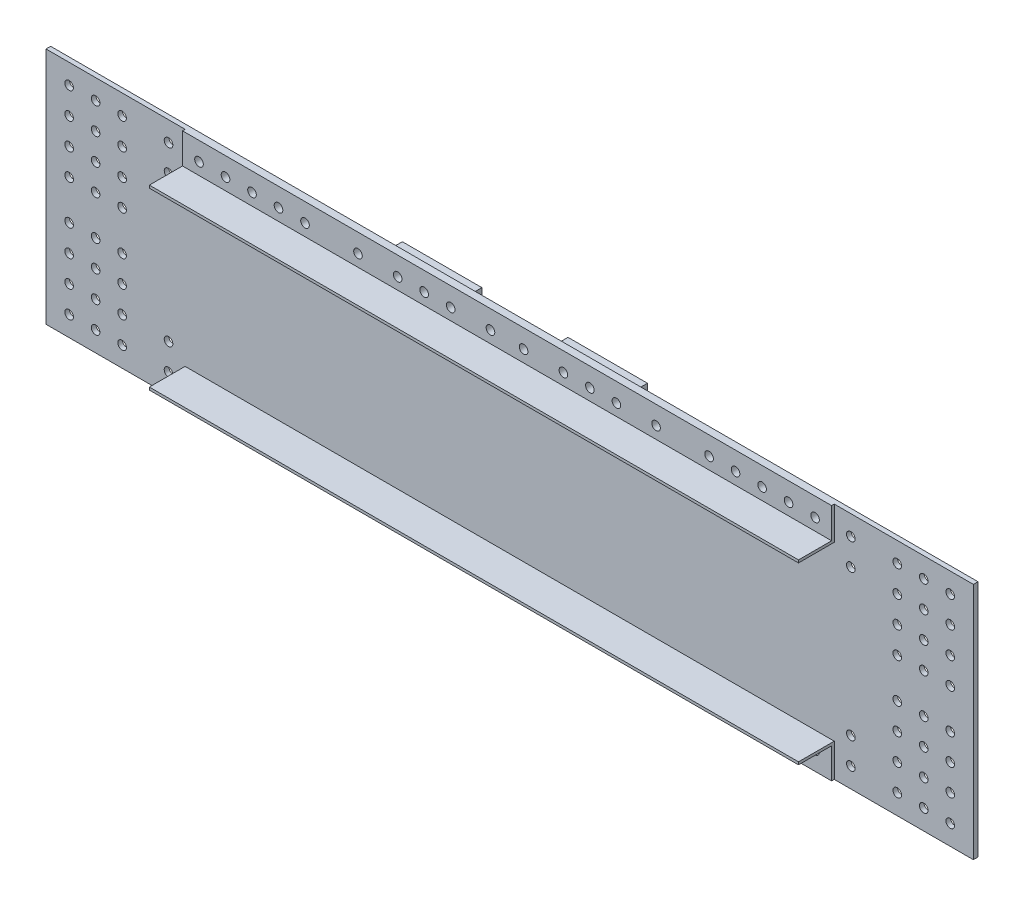
from build123d import *

# Parameters (mm, degrees)
SKETCH_1_W                  = 2800
SKETCH_1_H                  = 720
EXTRUDE_1_DEPTH             = 14
SKETCH_3_R                  = 13
CUT_EXTRUDE_1_DEPTH         = 1446.612672883
PATTERN_LINEAR_1_COUNT      = 3
PATTERN_LINEAR_1_PITCH      = 80
PATTERN_LINEAR_1_COUNT_DIR2 = 4
PATTERN_LINEAR_1_PITCH_DIR2 = 80
SKETCH_4_R                  = 13
CUT_EXTRUDE_2_DEPTH         = 1446.612672883
PATTERN_LINEAR_2_COUNT      = 2
PATTERN_LINEAR_2_PITCH      = 80
MIRROR_1_COPY_1_SKETCH_R    = 13
MIRROR_1_COPY_1_DEPTH       = 1446.612672883
MIRROR_1_COPY_2_SKETCH_R    = 13
MIRROR_1_COPY_2_DEPTH       = 1446.612672883
MIRROR_1_COPY_3_SKETCH_R    = 13
MIRROR_1_COPY_3_DEPTH       = 1446.612672883
MIRROR_1_COPY_4_SKETCH_R    = 13
MIRROR_1_COPY_4_DEPTH       = 1446.612672883
MIRROR_1_COPY_5_SKETCH_R    = 13
MIRROR_1_COPY_5_DEPTH       = 1446.612672883
MIRROR_1_COPY_6_SKETCH_R    = 13
MIRROR_1_COPY_6_DEPTH       = 1446.612672883
MIRROR_1_COPY_7_SKETCH_R    = 13
MIRROR_1_COPY_7_DEPTH       = 1446.612672883
MIRROR_1_COPY_8_SKETCH_R    = 13
MIRROR_1_COPY_8_DEPTH       = 1446.612672883
MIRROR_1_COPY_9_SKETCH_R    = 13
MIRROR_1_COPY_9_DEPTH       = 1446.612672883
MIRROR_1_COPY_10_SKETCH_R   = 13
MIRROR_1_COPY_10_DEPTH      = 1446.612672883
MIRROR_1_COPY_11_SKETCH_R   = 13
MIRROR_1_COPY_11_DEPTH      = 1446.612672883
MIRROR_1_COPY_12_SKETCH_R   = 13
MIRROR_1_COPY_12_DEPTH      = 1446.612672883
MIRROR_2_COPY_1_SKETCH_R    = 13
MIRROR_2_COPY_1_DEPTH       = 1446.612672883
MIRROR_2_COPY_2_SKETCH_R    = 13
MIRROR_2_COPY_2_DEPTH       = 1446.612672883
MIRROR_2_COPY_3_SKETCH_R    = 13
MIRROR_2_COPY_3_DEPTH       = 1446.612672883
MIRROR_2_COPY_4_SKETCH_R    = 13
MIRROR_2_COPY_4_DEPTH       = 1446.612672883
MIRROR_2_COPY_5_SKETCH_R    = 13
MIRROR_2_COPY_5_DEPTH       = 1446.612672883
MIRROR_2_COPY_6_SKETCH_R    = 13
MIRROR_2_COPY_6_DEPTH       = 1446.612672883
MIRROR_2_COPY_7_SKETCH_R    = 13
MIRROR_2_COPY_7_DEPTH       = 1446.612672883
MIRROR_2_COPY_8_SKETCH_R    = 13
MIRROR_2_COPY_8_DEPTH       = 1446.612672883
MIRROR_2_COPY_9_SKETCH_R    = 13
MIRROR_2_COPY_9_DEPTH       = 1446.612672883
MIRROR_2_COPY_10_SKETCH_R   = 13
MIRROR_2_COPY_10_DEPTH      = 1446.612672883
MIRROR_2_COPY_11_SKETCH_R   = 13
MIRROR_2_COPY_11_DEPTH      = 1446.612672883
MIRROR_2_COPY_12_SKETCH_R   = 13
MIRROR_2_COPY_12_DEPTH      = 1446.612672883
MIRROR_2_COPY_13_SKETCH_R   = 13
MIRROR_2_COPY_13_DEPTH      = 1446.612672883
MIRROR_2_COPY_14_SKETCH_R   = 13
MIRROR_2_COPY_14_DEPTH      = 1446.612672883
MIRROR_2_COPY_15_SKETCH_R   = 13
MIRROR_2_COPY_15_DEPTH      = 1446.612672883
MIRROR_2_COPY_16_SKETCH_R   = 13
MIRROR_2_COPY_16_DEPTH      = 1446.612672883
MIRROR_2_COPY_17_SKETCH_R   = 13
MIRROR_2_COPY_17_DEPTH      = 1446.612672883
MIRROR_2_COPY_18_SKETCH_R   = 13
MIRROR_2_COPY_18_DEPTH      = 1446.612672883
MIRROR_2_COPY_19_SKETCH_R   = 13
MIRROR_2_COPY_19_DEPTH      = 1446.612672883
MIRROR_2_COPY_20_SKETCH_R   = 13
MIRROR_2_COPY_20_DEPTH      = 1446.612672883
MIRROR_2_COPY_21_SKETCH_R   = 13
MIRROR_2_COPY_21_DEPTH      = 1446.612672883
MIRROR_2_COPY_22_SKETCH_R   = 13
MIRROR_2_COPY_22_DEPTH      = 1446.612672883
MIRROR_2_COPY_23_SKETCH_R   = 13
MIRROR_2_COPY_23_DEPTH      = 1446.612672883
MIRROR_2_COPY_24_SKETCH_R   = 13
MIRROR_2_COPY_24_DEPTH      = 1446.612672883
MIRROR_2_COPY_25_SKETCH_R   = 13
MIRROR_2_COPY_25_DEPTH      = 1446.612672883
MIRROR_2_COPY_26_SKETCH_R   = 13
MIRROR_2_COPY_26_DEPTH      = 1446.612672883
SKETCH_5_W                  = 980
SKETCH_5_H                  = 100
EXTRUDE_2_DEPTH             = 8
SKETCH_7_R                  = 13
CUT_EXTRUDE_3_DEPTH         = 1446.712281196
PATTERN_LINEAR_3_COUNT      = 5
PATTERN_LINEAR_3_PITCH      = 80
SKETCH_8_R                  = 13
CUT_EXTRUDE_4_DEPTH         = 1446.712281196
SKETCH_9_W                  = 980
SKETCH_9_H                  = 8
EXTRUDE_3_DEPTH             = 100
MIRROR_3_COPY_1_SKETCH_R    = 13
MIRROR_3_COPY_1_DEPTH       = 1446.712281196
MIRROR_3_COPY_2_SKETCH_R    = 13
MIRROR_3_COPY_2_DEPTH       = 1446.712281196
MIRROR_3_COPY_3_SKETCH_R    = 13
MIRROR_3_COPY_3_DEPTH       = 1446.712281196
MIRROR_3_COPY_4_SKETCH_R    = 13
MIRROR_3_COPY_4_DEPTH       = 1446.712281196
MIRROR_4_COPY_1_SKETCH_R    = 13
MIRROR_4_COPY_1_DEPTH       = 1446.712281196
MIRROR_4_COPY_2_SKETCH_R    = 13
MIRROR_4_COPY_2_DEPTH       = 1446.712281196
MIRROR_4_COPY_3_SKETCH_R    = 13
MIRROR_4_COPY_3_DEPTH       = 1446.712281196
MIRROR_4_COPY_4_SKETCH_R    = 13
MIRROR_4_COPY_4_DEPTH       = 1446.712281196
MIRROR_4_COPY_5_SKETCH_W    = 980
MIRROR_4_COPY_5_SKETCH_H    = 100
MIRROR_4_COPY_5_DEPTH       = 8
MIRROR_4_COPY_6_SKETCH_R    = 13
MIRROR_4_COPY_6_DEPTH       = 1446.712281196
MIRROR_4_COPY_7_SKETCH_R    = 13
MIRROR_4_COPY_7_DEPTH       = 1446.712281196
MIRROR_4_COPY_8_SKETCH_W    = 980
MIRROR_4_COPY_8_SKETCH_H    = 8
MIRROR_4_COPY_8_DEPTH       = 100
MIRROR_4_COPY_9_SKETCH_R    = 13
MIRROR_4_COPY_9_DEPTH       = 1446.712281196
MIRROR_4_COPY_10_SKETCH_R   = 13
MIRROR_4_COPY_10_DEPTH      = 1446.712281196
MIRROR_4_COPY_11_SKETCH_R   = 13
MIRROR_4_COPY_11_DEPTH      = 1446.712281196
MIRROR_4_COPY_12_SKETCH_R   = 13
MIRROR_4_COPY_12_DEPTH      = 1446.712281196
MIRROR_4_COPY_13_SKETCH_W   = 980
MIRROR_4_COPY_13_SKETCH_H   = 8
MIRROR_4_COPY_13_DEPTH      = 100
SKETCH_11_W                 = 240
SKETCH_11_H                 = 80
EXTRUDE_4_DEPTH             = 32
SKETCH_12_R                 = 13
CUT_EXTRUDE_5_DEPTH         = 1449.999654934
PATTERN_LINEAR_4_COUNT      = 3
PATTERN_LINEAR_4_PITCH      = 80
SKETCH_11_3_W               = 240
SKETCH_11_3_H               = 80
EXTRUDE_6_DEPTH             = 54
SKETCH_13_R                 = 13
CUT_EXTRUDE_6_DEPTH         = 1449.999654934
PATTERN_LINEAR_5_COUNT      = 3
PATTERN_LINEAR_5_PITCH      = 80
MIRROR_7_COPY_1_SKETCH_R    = 13
MIRROR_7_COPY_1_DEPTH       = 1449.999654934
MIRROR_7_COPY_2_SKETCH_R    = 13
MIRROR_7_COPY_2_DEPTH       = 1449.999654934
MIRROR_8_COPY_1_SKETCH_R    = 13
MIRROR_8_COPY_1_DEPTH       = 1449.999654934
MIRROR_8_COPY_2_SKETCH_R    = 13
MIRROR_8_COPY_2_DEPTH       = 1449.999654934
MIRROR_8_COPY_3_SKETCH_W    = 240
MIRROR_8_COPY_3_SKETCH_H    = 80
MIRROR_8_COPY_3_DEPTH       = 54
MIRROR_8_COPY_4_SKETCH_R    = 13
MIRROR_8_COPY_4_DEPTH       = 1449.999654934
MIRROR_8_COPY_5_SKETCH_R    = 13
MIRROR_8_COPY_5_DEPTH       = 1449.999654934
MIRROR_8_COPY_6_SKETCH_R    = 13
MIRROR_8_COPY_6_DEPTH       = 1449.999654934


with BuildPart() as part:
    # 草图1 → 凸台-拉伸1 (new body)
    with BuildSketch(Plane.XY):
        Rectangle(SKETCH_1_W, SKETCH_1_H)
    extrude(amount=EXTRUDE_1_DEPTH)

    # 草图3 → 切除-拉伸1 (cut, through all)
    with BuildSketch(Plane.XY.offset(14)):
        with Locations((-1330.210648338, 299.636572569)):
            Circle(SKETCH_3_R)
    cut_extrude_1 = extrude(amount=-CUT_EXTRUDE_1_DEPTH, mode=Mode.SUBTRACT)

    # 阵列(线性)1: Cut-Extrude 1 3 × 4
    with Locations(*[(i * PATTERN_LINEAR_1_PITCH, -j * PATTERN_LINEAR_1_PITCH_DIR2, 0) for i in range(PATTERN_LINEAR_1_COUNT) for j in range(PATTERN_LINEAR_1_COUNT_DIR2) if (i, j) != (0, 0)]):
        add(cut_extrude_1, mode=Mode.SUBTRACT)

    # 草图4 → 切除-拉伸2 (cut, through all)
    with BuildSketch(Plane.XY.offset(14)):
        with Locations((-1030.029167404, 300.016103943)):
            Circle(SKETCH_4_R)
    cut_extrude_2 = extrude(amount=-CUT_EXTRUDE_2_DEPTH, mode=Mode.SUBTRACT)

    # 阵列(线性)2: 切除-拉伸2 ×2
    with Locations(*[(0, -i * PATTERN_LINEAR_2_PITCH, 0) for i in range(1, PATTERN_LINEAR_2_COUNT)]):
        add(cut_extrude_2, mode=Mode.SUBTRACT)

    # 镜向1: 切除-拉伸1, 切除-拉伸2 across plane
    add(cut_extrude_1.mirror(Plane.ZX), mode=Mode.SUBTRACT)
    add(cut_extrude_2.mirror(Plane.ZX), mode=Mode.SUBTRACT)

    # 镜向1 copy 1 sketch → 镜向1 copy 1 (cut, through all)
    with BuildSketch(Plane(origin=(0, 80, 14), x_dir=(1, 0, 0), z_dir=(0, 0, 1))):
        with Locations((-1330.210648338, -299.636572569)):
            Circle(MIRROR_1_COPY_1_SKETCH_R)
    extrude(amount=-MIRROR_1_COPY_1_DEPTH, mode=Mode.SUBTRACT)

    # 镜向1 copy 2 sketch → 镜向1 copy 2 (cut, through all)
    with BuildSketch(Plane(origin=(0, 160, 14), x_dir=(1, 0, 0), z_dir=(0, 0, 1))):
        with Locations((-1330.210648338, -299.636572569)):
            Circle(MIRROR_1_COPY_2_SKETCH_R)
    extrude(amount=-MIRROR_1_COPY_2_DEPTH, mode=Mode.SUBTRACT)

    # 镜向1 copy 3 sketch → 镜向1 copy 3 (cut, through all)
    with BuildSketch(Plane(origin=(0, 240, 14), x_dir=(1, 0, 0), z_dir=(0, 0, 1))):
        with Locations((-1330.210648338, -299.636572569)):
            Circle(MIRROR_1_COPY_3_SKETCH_R)
    extrude(amount=-MIRROR_1_COPY_3_DEPTH, mode=Mode.SUBTRACT)

    # 镜向1 copy 4 sketch → 镜向1 copy 4 (cut, through all)
    with BuildSketch(Plane(origin=(80, 0, 14), x_dir=(1, 0, 0), z_dir=(0, 0, 1))):
        with Locations((-1330.210648338, -299.636572569)):
            Circle(MIRROR_1_COPY_4_SKETCH_R)
    extrude(amount=-MIRROR_1_COPY_4_DEPTH, mode=Mode.SUBTRACT)

    # 镜向1 copy 5 sketch → 镜向1 copy 5 (cut, through all)
    with BuildSketch(Plane(origin=(80, 80, 14), x_dir=(1, 0, 0), z_dir=(0, 0, 1))):
        with Locations((-1330.210648338, -299.636572569)):
            Circle(MIRROR_1_COPY_5_SKETCH_R)
    extrude(amount=-MIRROR_1_COPY_5_DEPTH, mode=Mode.SUBTRACT)

    # 镜向1 copy 6 sketch → 镜向1 copy 6 (cut, through all)
    with BuildSketch(Plane(origin=(80, 160, 14), x_dir=(1, 0, 0), z_dir=(0, 0, 1))):
        with Locations((-1330.210648338, -299.636572569)):
            Circle(MIRROR_1_COPY_6_SKETCH_R)
    extrude(amount=-MIRROR_1_COPY_6_DEPTH, mode=Mode.SUBTRACT)

    # 镜向1 copy 7 sketch → 镜向1 copy 7 (cut, through all)
    with BuildSketch(Plane(origin=(80, 240, 14), x_dir=(1, 0, 0), z_dir=(0, 0, 1))):
        with Locations((-1330.210648338, -299.636572569)):
            Circle(MIRROR_1_COPY_7_SKETCH_R)
    extrude(amount=-MIRROR_1_COPY_7_DEPTH, mode=Mode.SUBTRACT)

    # 镜向1 copy 8 sketch → 镜向1 copy 8 (cut, through all)
    with BuildSketch(Plane(origin=(160, 0, 14), x_dir=(1, 0, 0), z_dir=(0, 0, 1))):
        with Locations((-1330.210648338, -299.636572569)):
            Circle(MIRROR_1_COPY_8_SKETCH_R)
    extrude(amount=-MIRROR_1_COPY_8_DEPTH, mode=Mode.SUBTRACT)

    # 镜向1 copy 9 sketch → 镜向1 copy 9 (cut, through all)
    with BuildSketch(Plane(origin=(160, 80, 14), x_dir=(1, 0, 0), z_dir=(0, 0, 1))):
        with Locations((-1330.210648338, -299.636572569)):
            Circle(MIRROR_1_COPY_9_SKETCH_R)
    extrude(amount=-MIRROR_1_COPY_9_DEPTH, mode=Mode.SUBTRACT)

    # 镜向1 copy 10 sketch → 镜向1 copy 10 (cut, through all)
    with BuildSketch(Plane(origin=(160, 160, 14), x_dir=(1, 0, 0), z_dir=(0, 0, 1))):
        with Locations((-1330.210648338, -299.636572569)):
            Circle(MIRROR_1_COPY_10_SKETCH_R)
    extrude(amount=-MIRROR_1_COPY_10_DEPTH, mode=Mode.SUBTRACT)

    # 镜向1 copy 11 sketch → 镜向1 copy 11 (cut, through all)
    with BuildSketch(Plane(origin=(160, 240, 14), x_dir=(1, 0, 0), z_dir=(0, 0, 1))):
        with Locations((-1330.210648338, -299.636572569)):
            Circle(MIRROR_1_COPY_11_SKETCH_R)
    extrude(amount=-MIRROR_1_COPY_11_DEPTH, mode=Mode.SUBTRACT)

    # 镜向1 copy 12 sketch → 镜向1 copy 12 (cut, through all)
    with BuildSketch(Plane(origin=(0, 80, 14), x_dir=(1, 0, 0), z_dir=(0, 0, 1))):
        with Locations((-1030.029167404, -300.016103943)):
            Circle(MIRROR_1_COPY_12_SKETCH_R)
    extrude(amount=-MIRROR_1_COPY_12_DEPTH, mode=Mode.SUBTRACT)

    # 镜向2: 切除-拉伸1, 切除-拉伸2 across plane
    add(cut_extrude_1.mirror(Plane(origin=(0, 0, 0), x_dir=(0, 0, 1), z_dir=(1, 0, 0))), mode=Mode.SUBTRACT)
    add(cut_extrude_2.mirror(Plane(origin=(0, 0, 0), x_dir=(0, 0, 1), z_dir=(1, 0, 0))), mode=Mode.SUBTRACT)

    # 镜向2 copy 1 sketch → 镜向2 copy 1 (cut, through all)
    with BuildSketch(Plane(origin=(0, -80, 14), x_dir=(-1, 0, 0), z_dir=(0, 0, 1))):
        with Locations((-1330.210648338, -299.636572569)):
            Circle(MIRROR_2_COPY_1_SKETCH_R)
    extrude(amount=-MIRROR_2_COPY_1_DEPTH, mode=Mode.SUBTRACT)

    # 镜向2 copy 2 sketch → 镜向2 copy 2 (cut, through all)
    with BuildSketch(Plane(origin=(0, -160, 14), x_dir=(-1, 0, 0), z_dir=(0, 0, 1))):
        with Locations((-1330.210648338, -299.636572569)):
            Circle(MIRROR_2_COPY_2_SKETCH_R)
    extrude(amount=-MIRROR_2_COPY_2_DEPTH, mode=Mode.SUBTRACT)

    # 镜向2 copy 3 sketch → 镜向2 copy 3 (cut, through all)
    with BuildSketch(Plane(origin=(0, -240, 14), x_dir=(-1, 0, 0), z_dir=(0, 0, 1))):
        with Locations((-1330.210648338, -299.636572569)):
            Circle(MIRROR_2_COPY_3_SKETCH_R)
    extrude(amount=-MIRROR_2_COPY_3_DEPTH, mode=Mode.SUBTRACT)

    # 镜向2 copy 4 sketch → 镜向2 copy 4 (cut, through all)
    with BuildSketch(Plane(origin=(-80, 0, 14), x_dir=(-1, 0, 0), z_dir=(0, 0, 1))):
        with Locations((-1330.210648338, -299.636572569)):
            Circle(MIRROR_2_COPY_4_SKETCH_R)
    extrude(amount=-MIRROR_2_COPY_4_DEPTH, mode=Mode.SUBTRACT)

    # 镜向2 copy 5 sketch → 镜向2 copy 5 (cut, through all)
    with BuildSketch(Plane(origin=(-80, -80, 14), x_dir=(-1, 0, 0), z_dir=(0, 0, 1))):
        with Locations((-1330.210648338, -299.636572569)):
            Circle(MIRROR_2_COPY_5_SKETCH_R)
    extrude(amount=-MIRROR_2_COPY_5_DEPTH, mode=Mode.SUBTRACT)

    # 镜向2 copy 6 sketch → 镜向2 copy 6 (cut, through all)
    with BuildSketch(Plane(origin=(-80, -160, 14), x_dir=(-1, 0, 0), z_dir=(0, 0, 1))):
        with Locations((-1330.210648338, -299.636572569)):
            Circle(MIRROR_2_COPY_6_SKETCH_R)
    extrude(amount=-MIRROR_2_COPY_6_DEPTH, mode=Mode.SUBTRACT)

    # 镜向2 copy 7 sketch → 镜向2 copy 7 (cut, through all)
    with BuildSketch(Plane(origin=(-80, -240, 14), x_dir=(-1, 0, 0), z_dir=(0, 0, 1))):
        with Locations((-1330.210648338, -299.636572569)):
            Circle(MIRROR_2_COPY_7_SKETCH_R)
    extrude(amount=-MIRROR_2_COPY_7_DEPTH, mode=Mode.SUBTRACT)

    # 镜向2 copy 8 sketch → 镜向2 copy 8 (cut, through all)
    with BuildSketch(Plane(origin=(-160, 0, 14), x_dir=(-1, 0, 0), z_dir=(0, 0, 1))):
        with Locations((-1330.210648338, -299.636572569)):
            Circle(MIRROR_2_COPY_8_SKETCH_R)
    extrude(amount=-MIRROR_2_COPY_8_DEPTH, mode=Mode.SUBTRACT)

    # 镜向2 copy 9 sketch → 镜向2 copy 9 (cut, through all)
    with BuildSketch(Plane(origin=(-160, -80, 14), x_dir=(-1, 0, 0), z_dir=(0, 0, 1))):
        with Locations((-1330.210648338, -299.636572569)):
            Circle(MIRROR_2_COPY_9_SKETCH_R)
    extrude(amount=-MIRROR_2_COPY_9_DEPTH, mode=Mode.SUBTRACT)

    # 镜向2 copy 10 sketch → 镜向2 copy 10 (cut, through all)
    with BuildSketch(Plane(origin=(-160, -160, 14), x_dir=(-1, 0, 0), z_dir=(0, 0, 1))):
        with Locations((-1330.210648338, -299.636572569)):
            Circle(MIRROR_2_COPY_10_SKETCH_R)
    extrude(amount=-MIRROR_2_COPY_10_DEPTH, mode=Mode.SUBTRACT)

    # 镜向2 copy 11 sketch → 镜向2 copy 11 (cut, through all)
    with BuildSketch(Plane(origin=(-160, -240, 14), x_dir=(-1, 0, 0), z_dir=(0, 0, 1))):
        with Locations((-1330.210648338, -299.636572569)):
            Circle(MIRROR_2_COPY_11_SKETCH_R)
    extrude(amount=-MIRROR_2_COPY_11_DEPTH, mode=Mode.SUBTRACT)

    # 镜向2 copy 12 sketch → 镜向2 copy 12 (cut, through all)
    with BuildSketch(Plane(origin=(0, -80, 14), x_dir=(-1, 0, 0), z_dir=(0, 0, 1))):
        with Locations((-1030.029167404, -300.016103943)):
            Circle(MIRROR_2_COPY_12_SKETCH_R)
    extrude(amount=-MIRROR_2_COPY_12_DEPTH, mode=Mode.SUBTRACT)

    # 镜向2 copy 13 sketch → 镜向2 copy 13 (cut, through all)
    with BuildSketch(Plane(origin=(0, 0, 14), x_dir=(-1, 0, 0), z_dir=(0, 0, 1))):
        with Locations((-1330.210648338, 299.636572569)):
            Circle(MIRROR_2_COPY_13_SKETCH_R)
    extrude(amount=-MIRROR_2_COPY_13_DEPTH, mode=Mode.SUBTRACT)

    # 镜向2 copy 14 sketch → 镜向2 copy 14 (cut, through all)
    with BuildSketch(Plane(origin=(0, 0, 14), x_dir=(-1, 0, 0), z_dir=(0, 0, 1))):
        with Locations((-1030.029167404, 300.016103943)):
            Circle(MIRROR_2_COPY_14_SKETCH_R)
    extrude(amount=-MIRROR_2_COPY_14_DEPTH, mode=Mode.SUBTRACT)

    # 镜向2 copy 15 sketch → 镜向2 copy 15 (cut, through all)
    with BuildSketch(Plane(origin=(0, 80, 14), x_dir=(-1, 0, 0), z_dir=(0, 0, 1))):
        with Locations((-1330.210648338, 299.636572569)):
            Circle(MIRROR_2_COPY_15_SKETCH_R)
    extrude(amount=-MIRROR_2_COPY_15_DEPTH, mode=Mode.SUBTRACT)

    # 镜向2 copy 16 sketch → 镜向2 copy 16 (cut, through all)
    with BuildSketch(Plane(origin=(0, 160, 14), x_dir=(-1, 0, 0), z_dir=(0, 0, 1))):
        with Locations((-1330.210648338, 299.636572569)):
            Circle(MIRROR_2_COPY_16_SKETCH_R)
    extrude(amount=-MIRROR_2_COPY_16_DEPTH, mode=Mode.SUBTRACT)

    # 镜向2 copy 17 sketch → 镜向2 copy 17 (cut, through all)
    with BuildSketch(Plane(origin=(0, 240, 14), x_dir=(-1, 0, 0), z_dir=(0, 0, 1))):
        with Locations((-1330.210648338, 299.636572569)):
            Circle(MIRROR_2_COPY_17_SKETCH_R)
    extrude(amount=-MIRROR_2_COPY_17_DEPTH, mode=Mode.SUBTRACT)

    # 镜向2 copy 18 sketch → 镜向2 copy 18 (cut, through all)
    with BuildSketch(Plane(origin=(-80, 0, 14), x_dir=(-1, 0, 0), z_dir=(0, 0, 1))):
        with Locations((-1330.210648338, 299.636572569)):
            Circle(MIRROR_2_COPY_18_SKETCH_R)
    extrude(amount=-MIRROR_2_COPY_18_DEPTH, mode=Mode.SUBTRACT)

    # 镜向2 copy 19 sketch → 镜向2 copy 19 (cut, through all)
    with BuildSketch(Plane(origin=(-80, 80, 14), x_dir=(-1, 0, 0), z_dir=(0, 0, 1))):
        with Locations((-1330.210648338, 299.636572569)):
            Circle(MIRROR_2_COPY_19_SKETCH_R)
    extrude(amount=-MIRROR_2_COPY_19_DEPTH, mode=Mode.SUBTRACT)

    # 镜向2 copy 20 sketch → 镜向2 copy 20 (cut, through all)
    with BuildSketch(Plane(origin=(-80, 160, 14), x_dir=(-1, 0, 0), z_dir=(0, 0, 1))):
        with Locations((-1330.210648338, 299.636572569)):
            Circle(MIRROR_2_COPY_20_SKETCH_R)
    extrude(amount=-MIRROR_2_COPY_20_DEPTH, mode=Mode.SUBTRACT)

    # 镜向2 copy 21 sketch → 镜向2 copy 21 (cut, through all)
    with BuildSketch(Plane(origin=(-80, 240, 14), x_dir=(-1, 0, 0), z_dir=(0, 0, 1))):
        with Locations((-1330.210648338, 299.636572569)):
            Circle(MIRROR_2_COPY_21_SKETCH_R)
    extrude(amount=-MIRROR_2_COPY_21_DEPTH, mode=Mode.SUBTRACT)

    # 镜向2 copy 22 sketch → 镜向2 copy 22 (cut, through all)
    with BuildSketch(Plane(origin=(-160, 0, 14), x_dir=(-1, 0, 0), z_dir=(0, 0, 1))):
        with Locations((-1330.210648338, 299.636572569)):
            Circle(MIRROR_2_COPY_22_SKETCH_R)
    extrude(amount=-MIRROR_2_COPY_22_DEPTH, mode=Mode.SUBTRACT)

    # 镜向2 copy 23 sketch → 镜向2 copy 23 (cut, through all)
    with BuildSketch(Plane(origin=(-160, 80, 14), x_dir=(-1, 0, 0), z_dir=(0, 0, 1))):
        with Locations((-1330.210648338, 299.636572569)):
            Circle(MIRROR_2_COPY_23_SKETCH_R)
    extrude(amount=-MIRROR_2_COPY_23_DEPTH, mode=Mode.SUBTRACT)

    # 镜向2 copy 24 sketch → 镜向2 copy 24 (cut, through all)
    with BuildSketch(Plane(origin=(-160, 160, 14), x_dir=(-1, 0, 0), z_dir=(0, 0, 1))):
        with Locations((-1330.210648338, 299.636572569)):
            Circle(MIRROR_2_COPY_24_SKETCH_R)
    extrude(amount=-MIRROR_2_COPY_24_DEPTH, mode=Mode.SUBTRACT)

    # 镜向2 copy 25 sketch → 镜向2 copy 25 (cut, through all)
    with BuildSketch(Plane(origin=(-160, 240, 14), x_dir=(-1, 0, 0), z_dir=(0, 0, 1))):
        with Locations((-1330.210648338, 299.636572569)):
            Circle(MIRROR_2_COPY_25_SKETCH_R)
    extrude(amount=-MIRROR_2_COPY_25_DEPTH, mode=Mode.SUBTRACT)

    # 镜向2 copy 26 sketch → 镜向2 copy 26 (cut, through all)
    with BuildSketch(Plane(origin=(0, 80, 14), x_dir=(-1, 0, 0), z_dir=(0, 0, 1))):
        with Locations((-1030.029167404, 300.016103943)):
            Circle(MIRROR_2_COPY_26_SKETCH_R)
    extrude(amount=-MIRROR_2_COPY_26_DEPTH, mode=Mode.SUBTRACT)

    # 草图5 → 凸台-拉伸2 (add)
    with BuildSketch(Plane.XY.offset(14)):
        with Locations((-490, 310)):
            Rectangle(SKETCH_5_W, SKETCH_5_H)
    extrude_2 = extrude(amount=EXTRUDE_2_DEPTH)

    # 草图7 → 切除-拉伸3 (cut, through all)
    with BuildSketch(Plane.XY.offset(22)):
        with Locations((-930, 304)):
            Circle(SKETCH_7_R)
    cut_extrude_3 = extrude(amount=-CUT_EXTRUDE_3_DEPTH, mode=Mode.SUBTRACT)

    # 阵列(线性)3: 切除-拉伸3 ×5
    with Locations(*[(i * PATTERN_LINEAR_3_PITCH, 0, 0) for i in range(1, PATTERN_LINEAR_3_COUNT)]):
        add(cut_extrude_3, mode=Mode.SUBTRACT)

    # 草图8 → 切除-拉伸4 (cut, through all)
    with BuildSketch(Plane.XY.offset(22)):
        with Locations((-450, 304)):
            Circle(SKETCH_8_R)
        with Locations((-50, 304)):
            Circle(SKETCH_8_R)
    cut_extrude_4 = extrude(amount=-CUT_EXTRUDE_4_DEPTH, mode=Mode.SUBTRACT)

    # 草图9 → 凸台-拉伸3 (add)
    with BuildSketch(Plane.XY.offset(22)):
        with Locations((-490, 264)):
            Rectangle(SKETCH_9_W, SKETCH_9_H)
    extrude_3 = extrude(amount=EXTRUDE_3_DEPTH)

    # 镜向3: 凸台-拉伸2, 切除-拉伸3, 切除-拉伸4, 凸台-拉伸3 across plane
    add(extrude_2.mirror(Plane.ZX))
    add(cut_extrude_3.mirror(Plane.ZX), mode=Mode.SUBTRACT)
    add(cut_extrude_4.mirror(Plane.ZX), mode=Mode.SUBTRACT)
    add(extrude_3.mirror(Plane.ZX))

    # 镜向3 copy 1 sketch → 镜向3 copy 1 (cut, through all)
    with BuildSketch(Plane(origin=(80, 0, 22), x_dir=(1, 0, 0), z_dir=(0, 0, 1))):
        with Locations((-930, -304)):
            Circle(MIRROR_3_COPY_1_SKETCH_R)
    extrude(amount=-MIRROR_3_COPY_1_DEPTH, mode=Mode.SUBTRACT)

    # 镜向3 copy 2 sketch → 镜向3 copy 2 (cut, through all)
    with BuildSketch(Plane(origin=(160, 0, 22), x_dir=(1, 0, 0), z_dir=(0, 0, 1))):
        with Locations((-930, -304)):
            Circle(MIRROR_3_COPY_2_SKETCH_R)
    extrude(amount=-MIRROR_3_COPY_2_DEPTH, mode=Mode.SUBTRACT)

    # 镜向3 copy 3 sketch → 镜向3 copy 3 (cut, through all)
    with BuildSketch(Plane(origin=(240, 0, 22), x_dir=(1, 0, 0), z_dir=(0, 0, 1))):
        with Locations((-930, -304)):
            Circle(MIRROR_3_COPY_3_SKETCH_R)
    extrude(amount=-MIRROR_3_COPY_3_DEPTH, mode=Mode.SUBTRACT)

    # 镜向3 copy 4 sketch → 镜向3 copy 4 (cut, through all)
    with BuildSketch(Plane(origin=(320, 0, 22), x_dir=(1, 0, 0), z_dir=(0, 0, 1))):
        with Locations((-930, -304)):
            Circle(MIRROR_3_COPY_4_SKETCH_R)
    extrude(amount=-MIRROR_3_COPY_4_DEPTH, mode=Mode.SUBTRACT)

    # 镜向4: 凸台-拉伸2, 切除-拉伸3, 切除-拉伸4 across plane
    add(extrude_2.mirror(Plane(origin=(0, 0, 0), x_dir=(0, 0, 1), z_dir=(1, 0, 0))))
    add(cut_extrude_3.mirror(Plane(origin=(0, 0, 0), x_dir=(0, 0, 1), z_dir=(1, 0, 0))), mode=Mode.SUBTRACT)
    add(cut_extrude_4.mirror(Plane(origin=(0, 0, 0), x_dir=(0, 0, 1), z_dir=(1, 0, 0))), mode=Mode.SUBTRACT)

    # 镜向4 copy 1 sketch → 镜向4 copy 1 (cut, through all)
    with BuildSketch(Plane(origin=(-80, 0, 22), x_dir=(-1, 0, 0), z_dir=(0, 0, 1))):
        with Locations((-930, -304)):
            Circle(MIRROR_4_COPY_1_SKETCH_R)
    extrude(amount=-MIRROR_4_COPY_1_DEPTH, mode=Mode.SUBTRACT)

    # 镜向4 copy 2 sketch → 镜向4 copy 2 (cut, through all)
    with BuildSketch(Plane(origin=(-160, 0, 22), x_dir=(-1, 0, 0), z_dir=(0, 0, 1))):
        with Locations((-930, -304)):
            Circle(MIRROR_4_COPY_2_SKETCH_R)
    extrude(amount=-MIRROR_4_COPY_2_DEPTH, mode=Mode.SUBTRACT)

    # 镜向4 copy 3 sketch → 镜向4 copy 3 (cut, through all)
    with BuildSketch(Plane(origin=(-240, 0, 22), x_dir=(-1, 0, 0), z_dir=(0, 0, 1))):
        with Locations((-930, -304)):
            Circle(MIRROR_4_COPY_3_SKETCH_R)
    extrude(amount=-MIRROR_4_COPY_3_DEPTH, mode=Mode.SUBTRACT)

    # 镜向4 copy 4 sketch → 镜向4 copy 4 (cut, through all)
    with BuildSketch(Plane(origin=(-320, 0, 22), x_dir=(-1, 0, 0), z_dir=(0, 0, 1))):
        with Locations((-930, -304)):
            Circle(MIRROR_4_COPY_4_SKETCH_R)
    extrude(amount=-MIRROR_4_COPY_4_DEPTH, mode=Mode.SUBTRACT)

    # 镜向4 copy 5 sketch → 镜向4 copy 5 (add)
    with BuildSketch(Plane(origin=(0, 0, 14), x_dir=(-1, 0, 0), z_dir=(0, 0, 1))):
        with Locations((-490, 310)):
            Rectangle(MIRROR_4_COPY_5_SKETCH_W, MIRROR_4_COPY_5_SKETCH_H)
    extrude(amount=MIRROR_4_COPY_5_DEPTH)

    # 镜向4 copy 6 sketch → 镜向4 copy 6 (cut, through all)
    with BuildSketch(Plane(origin=(0, 0, 22), x_dir=(-1, 0, 0), z_dir=(0, 0, 1))):
        with Locations((-930, 304)):
            Circle(MIRROR_4_COPY_6_SKETCH_R)
    extrude(amount=-MIRROR_4_COPY_6_DEPTH, mode=Mode.SUBTRACT)

    # 镜向4 copy 7 sketch → 镜向4 copy 7 (cut, through all)
    with BuildSketch(Plane(origin=(0, 0, 22), x_dir=(-1, 0, 0), z_dir=(0, 0, 1))):
        with Locations((-450, 304)):
            Circle(MIRROR_4_COPY_7_SKETCH_R)
        with Locations((-50, 304)):
            Circle(MIRROR_4_COPY_7_SKETCH_R)
    extrude(amount=-MIRROR_4_COPY_7_DEPTH, mode=Mode.SUBTRACT)

    # 镜向4 copy 8 sketch → 镜向4 copy 8 (add)
    with BuildSketch(Plane(origin=(0, 0, 22), x_dir=(-1, 0, 0), z_dir=(0, 0, 1))):
        with Locations((-490, 264)):
            Rectangle(MIRROR_4_COPY_8_SKETCH_W, MIRROR_4_COPY_8_SKETCH_H)
    extrude(amount=MIRROR_4_COPY_8_DEPTH)

    # 镜向4 copy 9 sketch → 镜向4 copy 9 (cut, through all)
    with BuildSketch(Plane(origin=(-80, 0, 22), x_dir=(-1, 0, 0), z_dir=(0, 0, 1))):
        with Locations((-930, 304)):
            Circle(MIRROR_4_COPY_9_SKETCH_R)
    extrude(amount=-MIRROR_4_COPY_9_DEPTH, mode=Mode.SUBTRACT)

    # 镜向4 copy 10 sketch → 镜向4 copy 10 (cut, through all)
    with BuildSketch(Plane(origin=(-160, 0, 22), x_dir=(-1, 0, 0), z_dir=(0, 0, 1))):
        with Locations((-930, 304)):
            Circle(MIRROR_4_COPY_10_SKETCH_R)
    extrude(amount=-MIRROR_4_COPY_10_DEPTH, mode=Mode.SUBTRACT)

    # 镜向4 copy 11 sketch → 镜向4 copy 11 (cut, through all)
    with BuildSketch(Plane(origin=(-240, 0, 22), x_dir=(-1, 0, 0), z_dir=(0, 0, 1))):
        with Locations((-930, 304)):
            Circle(MIRROR_4_COPY_11_SKETCH_R)
    extrude(amount=-MIRROR_4_COPY_11_DEPTH, mode=Mode.SUBTRACT)

    # 镜向4 copy 12 sketch → 镜向4 copy 12 (cut, through all)
    with BuildSketch(Plane(origin=(-320, 0, 22), x_dir=(-1, 0, 0), z_dir=(0, 0, 1))):
        with Locations((-930, 304)):
            Circle(MIRROR_4_COPY_12_SKETCH_R)
    extrude(amount=-MIRROR_4_COPY_12_DEPTH, mode=Mode.SUBTRACT)

    # 镜向4 copy 13 sketch → 镜向4 copy 13 (add)
    with BuildSketch(Plane(origin=(0, 0, 22), x_dir=(-1, 0, 0), z_dir=(0, 0, 1))):
        with Locations((-490, -264)):
            Rectangle(MIRROR_4_COPY_13_SKETCH_W, MIRROR_4_COPY_13_SKETCH_H)
    extrude(amount=MIRROR_4_COPY_13_DEPTH)

    # 草图11 → 凸台-拉伸4 (add)
    with BuildSketch(Plane.XY.offset(22)):
        with Locations((-250, 308)):
            Rectangle(SKETCH_11_W, SKETCH_11_H)
    extrude(amount=-EXTRUDE_4_DEPTH)

    # 草图12 → 切除-拉伸5 (cut, through all)
    with BuildSketch(Plane.XY.offset(22)):
        with Locations((-330, 304)):
            Circle(SKETCH_12_R)
    cut_extrude_5 = extrude(amount=-CUT_EXTRUDE_5_DEPTH, mode=Mode.SUBTRACT)

    # 阵列(线性)4: 切除-拉伸5 ×3
    with Locations(*[(i * PATTERN_LINEAR_4_PITCH, 0, 0) for i in range(1, PATTERN_LINEAR_4_COUNT)]):
        add(cut_extrude_5, mode=Mode.SUBTRACT)

    # 草图11<3> → 凸台-拉伸6 (add)
    with BuildSketch(Plane.XY.offset(22)):
        with Locations((-250, 308)):
            Rectangle(SKETCH_11_3_W, SKETCH_11_3_H)
    extrude_6 = extrude(amount=-EXTRUDE_6_DEPTH)

    # 草图13 → 切除-拉伸6 (cut, through all)
    with BuildSketch(Plane.XY.offset(22)):
        with Locations((-330.204145294, 303.194442938)):
            Circle(SKETCH_13_R)
    cut_extrude_6 = extrude(amount=-CUT_EXTRUDE_6_DEPTH, mode=Mode.SUBTRACT)

    # 阵列(线性)5: 切除-拉伸6 ×3
    with Locations(*[(i * PATTERN_LINEAR_5_PITCH, 0, 0) for i in range(1, PATTERN_LINEAR_5_COUNT)]):
        add(cut_extrude_6, mode=Mode.SUBTRACT)

    # 镜向7: 凸台-拉伸6, 切除-拉伸6 across plane
    add(extrude_6.mirror(Plane.ZX))
    add(cut_extrude_6.mirror(Plane.ZX), mode=Mode.SUBTRACT)

    # 镜向7 copy 1 sketch → 镜向7 copy 1 (cut, through all)
    with BuildSketch(Plane(origin=(80, 0, 22), x_dir=(1, 0, 0), z_dir=(0, 0, 1))):
        with Locations((-330.204145294, -303.194442938)):
            Circle(MIRROR_7_COPY_1_SKETCH_R)
    extrude(amount=-MIRROR_7_COPY_1_DEPTH, mode=Mode.SUBTRACT)

    # 镜向7 copy 2 sketch → 镜向7 copy 2 (cut, through all)
    with BuildSketch(Plane(origin=(160, 0, 22), x_dir=(1, 0, 0), z_dir=(0, 0, 1))):
        with Locations((-330.204145294, -303.194442938)):
            Circle(MIRROR_7_COPY_2_SKETCH_R)
    extrude(amount=-MIRROR_7_COPY_2_DEPTH, mode=Mode.SUBTRACT)

    # 镜向8: 凸台-拉伸6, 切除-拉伸6 across plane
    add(extrude_6.mirror(Plane(origin=(0, 0, 0), x_dir=(0, 0, 1), z_dir=(1, 0, 0))))
    add(cut_extrude_6.mirror(Plane(origin=(0, 0, 0), x_dir=(0, 0, 1), z_dir=(1, 0, 0))), mode=Mode.SUBTRACT)

    # 镜向8 copy 1 sketch → 镜向8 copy 1 (cut, through all)
    with BuildSketch(Plane(origin=(-80, 0, 22), x_dir=(-1, 0, 0), z_dir=(0, 0, 1))):
        with Locations((-330.204145294, -303.194442938)):
            Circle(MIRROR_8_COPY_1_SKETCH_R)
    extrude(amount=-MIRROR_8_COPY_1_DEPTH, mode=Mode.SUBTRACT)

    # 镜向8 copy 2 sketch → 镜向8 copy 2 (cut, through all)
    with BuildSketch(Plane(origin=(-160, 0, 22), x_dir=(-1, 0, 0), z_dir=(0, 0, 1))):
        with Locations((-330.204145294, -303.194442938)):
            Circle(MIRROR_8_COPY_2_SKETCH_R)
    extrude(amount=-MIRROR_8_COPY_2_DEPTH, mode=Mode.SUBTRACT)

    # 镜向8 copy 3 sketch → 镜向8 copy 3 (add)
    with BuildSketch(Plane(origin=(0, 0, 22), x_dir=(-1, 0, 0), z_dir=(0, 0, 1))):
        with Locations((-250, 308)):
            Rectangle(MIRROR_8_COPY_3_SKETCH_W, MIRROR_8_COPY_3_SKETCH_H)
    extrude(amount=-MIRROR_8_COPY_3_DEPTH)

    # 镜向8 copy 4 sketch → 镜向8 copy 4 (cut, through all)
    with BuildSketch(Plane(origin=(0, 0, 22), x_dir=(-1, 0, 0), z_dir=(0, 0, 1))):
        with Locations((-330.204145294, 303.194442938)):
            Circle(MIRROR_8_COPY_4_SKETCH_R)
    extrude(amount=-MIRROR_8_COPY_4_DEPTH, mode=Mode.SUBTRACT)

    # 镜向8 copy 5 sketch → 镜向8 copy 5 (cut, through all)
    with BuildSketch(Plane(origin=(-80, 0, 22), x_dir=(-1, 0, 0), z_dir=(0, 0, 1))):
        with Locations((-330.204145294, 303.194442938)):
            Circle(MIRROR_8_COPY_5_SKETCH_R)
    extrude(amount=-MIRROR_8_COPY_5_DEPTH, mode=Mode.SUBTRACT)

    # 镜向8 copy 6 sketch → 镜向8 copy 6 (cut, through all)
    with BuildSketch(Plane(origin=(-160, 0, 22), x_dir=(-1, 0, 0), z_dir=(0, 0, 1))):
        with Locations((-330.204145294, 303.194442938)):
            Circle(MIRROR_8_COPY_6_SKETCH_R)
    extrude(amount=-MIRROR_8_COPY_6_DEPTH, mode=Mode.SUBTRACT)


solid = part.part
